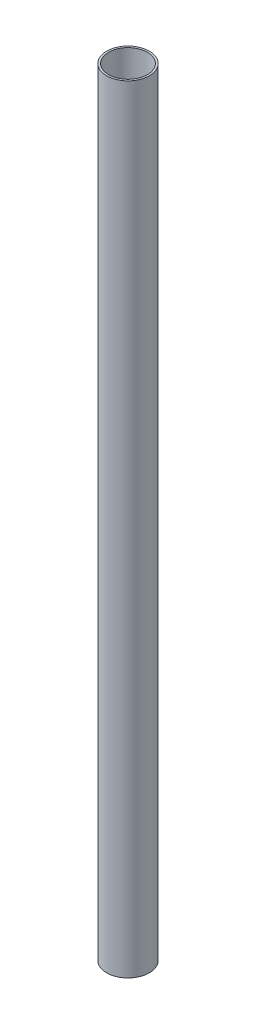
from build123d import *

# Parameters (mm, degrees)
ESQUISSE3_R        = 11
ESQUISSE3_R_2      = 10
BOSS_EXTRU_1_DEPTH = 400


with BuildPart() as part:
    # Esquisse3 → Boss.-Extru.1 (new body)
    with BuildSketch(Plane(origin=(0, 0, 0), x_dir=(1, 0, 0), z_dir=(0, 1, 0))):
        with Locations(Location((0, 0, 0), (0, 0, 270))):
            Circle(ESQUISSE3_R)
        with Locations(Location((0, 0, 0), (0, 0, 270))):
            Circle(ESQUISSE3_R_2, mode=Mode.SUBTRACT)
    extrude(amount=BOSS_EXTRU_1_DEPTH)


solid = part.part
